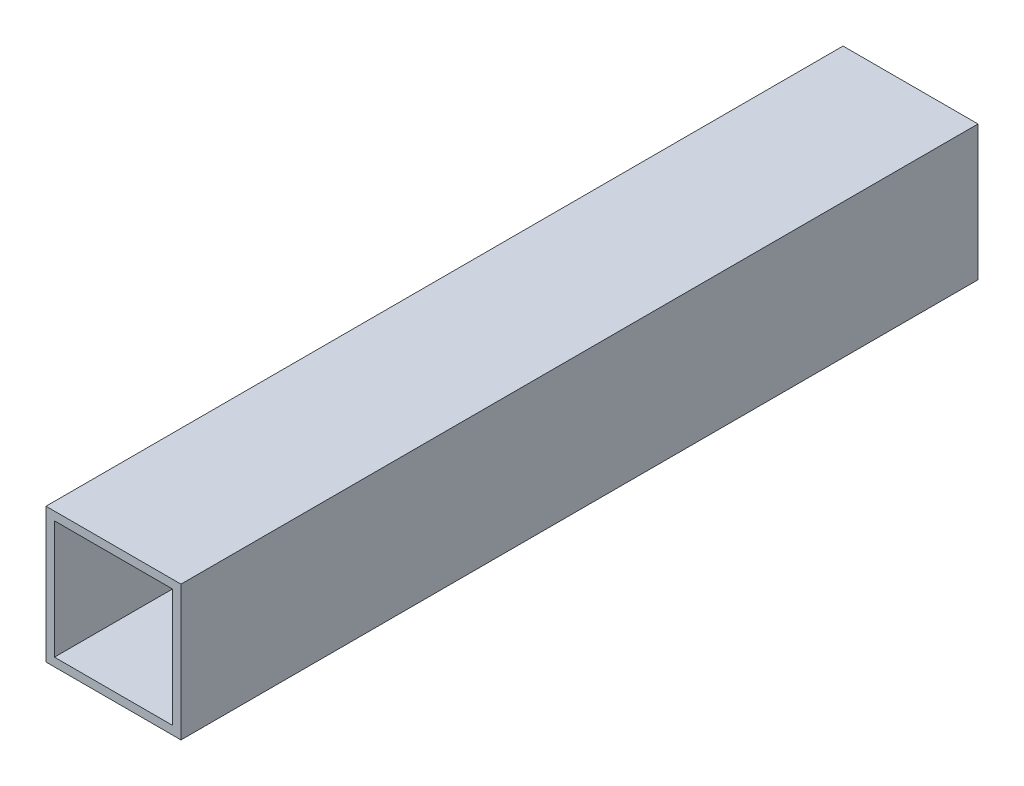
from build123d import *

# Parameters (mm, degrees)
SKETCH1_W           = 25.4
SKETCH1_H           = 25.4
SKETCH1_W_2         = 22.225
SKETCH1_H_2         = 22.225
BOSS_EXTRUDE1_DEPTH = 75


with BuildPart() as part:
    # Sketch1 → Boss-Extrude1 (new, symmetric)
    with BuildSketch(Plane.XY):
        Rectangle(SKETCH1_W, SKETCH1_H)
        Rectangle(SKETCH1_W_2, SKETCH1_H_2, mode=Mode.SUBTRACT)
    extrude(amount=BOSS_EXTRUDE1_DEPTH, both=True)


solid = part.part
